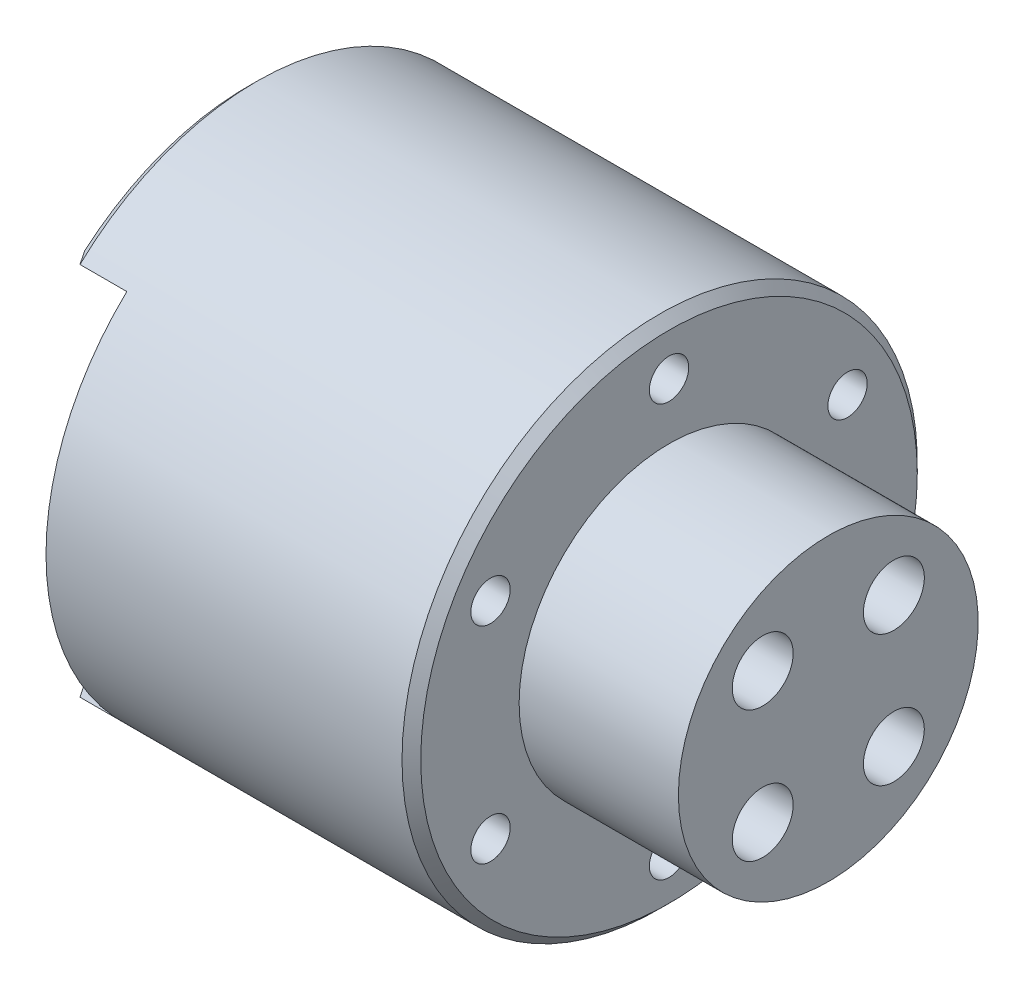
from build123d import *

# Parameters (mm, degrees)
SKETCH2_R          = 3.25
CUT_EXTRUDE1_DEPTH = 74.188113789
SKETCH3_R          = 2.1
CUT_EXTRUDE2_DEPTH = 20
CIRPATTERN1_COUNT  = 6
CHAMFER1_SIZE      = 1
CUT_EXTRUDE3_START = -6
CUT_EXTRUDE3_DEPTH = 6


with BuildPart() as part:
    # Sketch1 → Revolve1 (revolve)
    with BuildSketch(Plane.XY):
        Polygon((0, 0), (0, 27.5), (45, 27.5), (45, 16), (62, 16), (62, 0), align=None)
    revolve(axis=Axis((0, 0, 0), (1, 0, 0)))

    # Sketch2 → Cut-Extrude1 (cut, through all)
    with BuildSketch(Plane.ZY):
        with Locations((-7, 7)):
            Circle(SKETCH2_R)
        with Locations((7, 7)):
            Circle(SKETCH2_R)
        with Locations((7, -7)):
            Circle(SKETCH2_R)
        with Locations((-7, -7)):
            Circle(SKETCH2_R)
    extrude(amount=-CUT_EXTRUDE1_DEPTH, mode=Mode.SUBTRACT)

    # Sketch3 → Cut-Extrude2 (cut)
    with BuildSketch(Plane(origin=(45, 0, 0), x_dir=(0, 0, -1), z_dir=(1, 0, 0))):
        with Locations((0, 22)):
            Circle(SKETCH3_R)
    cut_extrude2 = extrude(amount=-CUT_EXTRUDE2_DEPTH, mode=Mode.SUBTRACT)

    # CirPattern1: Cut-Extrude2 ×6 about axis
    cirpattern1_axis = Axis((45, 0, 0), (-1, 0, 0))
    for i in range(1, CIRPATTERN1_COUNT):
        add(cut_extrude2.rotate(cirpattern1_axis, i * 360 / CIRPATTERN1_COUNT), mode=Mode.SUBTRACT)

    # Chamfer1
    chamfer1_edges = [part.edges().sort_by_distance(p)[0] for p in [
        (0, -27.5, 0),
        (45, -27.5, 0),
        (0, 7, -10.25),
        (0, 7, 3.75),
        (0, -7, 3.75),
        (0, -7, -10.25),
    ]]
    chamfer(chamfer1_edges, length=CHAMFER1_SIZE)

    # Sketch4 → Cut-Extrude3 (cut)
    with BuildSketch(Plane.ZY.offset(CUT_EXTRUDE3_START)):
        with BuildLine():
            Line((-18.874586088, 20), (18.874586088, 20))
            ThreePointArc((18.874586088, 20), (27.5, 0), (18.874586088, -20))
            Line((18.874586088, -20), (-18.874586088, -20))
            ThreePointArc((-18.874586088, -20), (-27.5, 0), (-18.874586088, 20))
        make_face()
    extrude(amount=CUT_EXTRUDE3_DEPTH, mode=Mode.SUBTRACT)


solid = part.part
